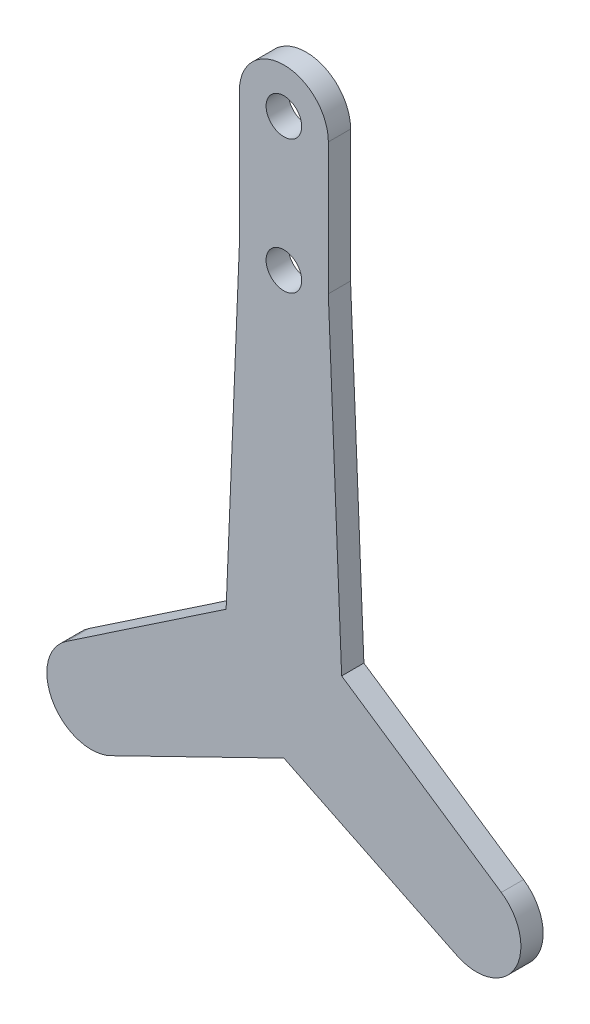
from build123d import *

# Parameters (mm, degrees)
BOSS_EXTRUDE1_DEPTH = 5
SKETCH3_R           = 4
CUT_EXTRUDE1_DEPTH  = 5


with BuildPart() as part:
    # Sketch1 → Boss-Extrude1 (new body)
    with BuildSketch(Plane.XY):
        with BuildLine():
            Line((-38.916331436, -113.987341772), (0, -95))
            Line((0, -95), (38.916331436, -113.987341772))
            ThreePointArc((38.916331436, -113.987341772), (51.961524227, -110), (48.8920671, -96.708860759))
            Line((48.8920671, -96.708860759), (12.990381057, -72.5))
            Line((12.990381057, -72.5), (9.991552325, 0.410952718))
            Line((9.991552325, 0.410952718), (10, 30))
            ThreePointArc((10, 30), (0, 40), (-10, 30))
            Line((-10, 30), (-9.991552325, 0.410952718))
            Line((-9.991552325, 0.410952718), (-12.990381057, -72.5))
            Line((-12.990381057, -72.5), (-48.8920671, -96.708860759))
            ThreePointArc((-48.8920671, -96.708860759), (-51.961524227, -110), (-38.916331436, -113.987341772))
        make_face()
    extrude(amount=BOSS_EXTRUDE1_DEPTH)

    # Sketch3 → Cut-Extrude1 (cut)
    with BuildSketch(Plane(origin=(0, 0, 0), x_dir=(-1, 0, 0), z_dir=(0, 0, -1))):
        with Locations((0, 30)):
            Circle(SKETCH3_R)
        Circle(SKETCH3_R)
    extrude(amount=-CUT_EXTRUDE1_DEPTH, mode=Mode.SUBTRACT)


solid = part.part
